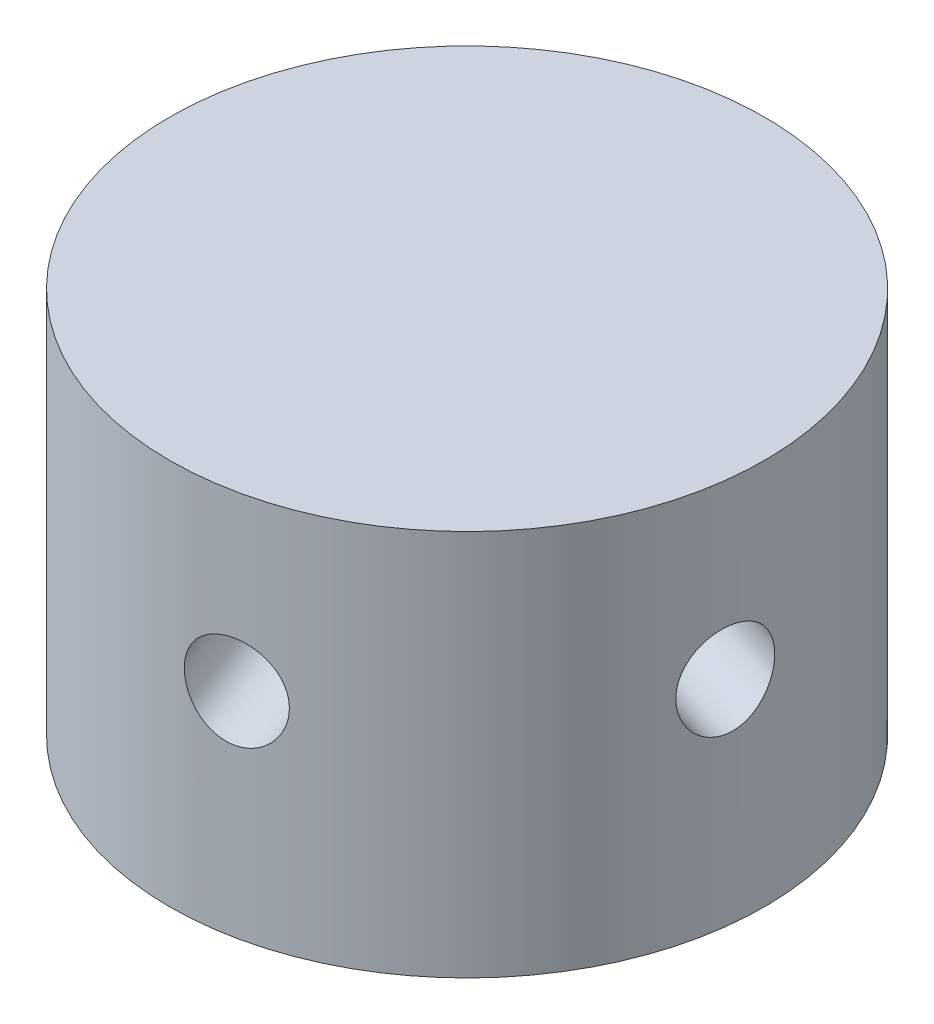
from build123d import *

# Parameters (mm, degrees)
BOSS_EXTRUDE1_DEPTH      = 3
BOSS_EXTRUDE1_DEPTH_BACK = 10
SKETCH1_R                = 10
SKETCH4_R                = 1.5
HOLE_DEPTH               = 20.973741561
HOLECIR_COUNT            = 5
SKETCH6_R                = 3
BEARINGHOLE_DEPTH        = 1.25
SKETCH7_R                = 1.5
SHAFTHOLE_DEPTH          = 17.248076982
SKETCH8_W                = 1.346153846
SKETCH8_H                = 0.358974359
SKETCH8_W_2              = 0.314102564
SKETCH8_H_2              = 2.557692308
BOSS_EXTRUDE3_DEPTH      = 1


with BuildPart() as part:
    # Sketch1 → Boss-Extrude1 (new, two sides: drawn at the far end of the back side and taken through both)
    with BuildSketch(Plane(origin=(0, 0, 0), x_dir=(1, 0, 0), z_dir=(0, 1, 0)).offset(-BOSS_EXTRUDE1_DEPTH_BACK)):
        Circle(SKETCH1_R)
    extrude(amount=BOSS_EXTRUDE1_DEPTH + BOSS_EXTRUDE1_DEPTH_BACK)

    # Sketch4 → hole (cut, through all)
    with BuildSketch(Plane(origin=(-3.352872105, -1.093066116, 1.887711608), x_dir=(-0.4486862613641547, -0.14627571033740308, -0.8816371449912632), z_dir=(0.8382180262940947, 0.2732665289126682, -0.47192790187872385))):
        Circle(SKETCH4_R)
    hole = extrude(amount=-HOLE_DEPTH, mode=Mode.SUBTRACT)

    # holecir: hole ×5 about axis
    holecir_axis = Axis((0, 5.5, 0), (0, -1, 0))
    for i in range(1, HOLECIR_COUNT):
        add(hole.rotate(holecir_axis, i * 360 / HOLECIR_COUNT), mode=Mode.SUBTRACT)

    # Sketch6 → bearinghole (cut, symmetric)
    with BuildSketch(Plane(origin=(0, -5, 0), x_dir=(-1, 0, 0), z_dir=(0, -1, 0))):
        Circle(SKETCH6_R)
    extrude(amount=BEARINGHOLE_DEPTH, both=True, mode=Mode.SUBTRACT)

    # Sketch7 → shafthole (cut, through all)
    with BuildSketch(Plane(origin=(0, -5, 0), x_dir=(-1, 0, 0), z_dir=(0, -1, 0))):
        Circle(SKETCH7_R)
    extrude(amount=SHAFTHOLE_DEPTH, mode=Mode.SUBTRACT)

    # Sketch8 → Boss-Extrude3 (add)
    # profile 1 of 7: a face of its own
    with BuildSketch(Plane.XZ.offset(10)):
        with BuildLine():
            Line((-4.105763014, 6.129780863), (-4.105763014, 5.770806504))
            Line((-4.105763014, 5.770806504), (-5.296267821, 5.770806504))
            Line((-5.296267821, 5.770806504), (-5.484869584, 4.850233588))
            add(Edge.make_bspline(
                [(-5.484869584, 4.850233588), (-5.44781371, 4.860463859), (-5.376023814, 4.880283393), (-5.270063953, 4.902289163), (-5.16947175, 4.915554607), (-5.104196379, 4.917365918), (-5.072609969, 4.918242402)],
                knots=[0, 0, 0, 0, 1.100273476, 2.13160584, 3.095893838, 4, 4, 4, 4], degree=3))
            add(Edge.make_bspline(
                [(-5.072609969, 4.918242402), (-5.033526229, 4.917396466), (-4.956677832, 4.915733145), (-4.844238885, 4.899761296), (-4.736905992, 4.874621381), (-4.634903621, 4.839500859), (-4.538043071, 4.794591126), (-4.447215509, 4.738491186), (-4.361057596, 4.672957855), (-4.281115002, 4.597612843), (-4.208590694, 4.514691226), (-4.144824705, 4.425533355), (-4.090662114, 4.331005693), (-4.047101359, 4.230205084), (-4.012317025, 4.12424593), (-3.98916503, 4.012013348), (-3.973748321, 3.894565228), (-3.972025935, 3.814260658), (-3.971147629, 3.773310511)],
                knots=[0, 0, 0, 0, 1.052922333, 2.070308379, 3.05430497, 4.020497103, 4.973039431, 5.925935799, 6.892292201, 7.88610001, 8.88166317, 9.857072816, 10.836096531, 11.812156883, 12.81219415, 13.836441305, 14.89672472, 16, 16, 16, 16], degree=3))
            add(Edge.make_bspline(
                [(-3.971147629, 3.773310511), (-3.971812704, 3.74478829), (-3.973133867, 3.688129303), (-3.979852455, 3.603985102), (-3.992788171, 3.521622269), (-4.010155895, 3.441029877), (-4.032698313, 3.362360505), (-4.059987367, 3.285388977), (-4.093383394, 3.21059437), (-4.13001477, 3.137268975), (-4.171261248, 3.067070468), (-4.217039755, 3.001421481), (-4.265405246, 2.9393372), (-4.317446632, 2.881483467), (-4.373647627, 2.828240449), (-4.433327594, 2.779292168), (-4.496010313, 2.733810837), (-4.562665555, 2.693642642), (-4.631808038, 2.656679686), (-4.704436255, 2.626356149), (-4.778896955, 2.599245621), (-4.856261831, 2.577636093), (-4.936355644, 2.560703538), (-5.019310419, 2.549202938), (-5.104691089, 2.5408265), (-5.162566102, 2.540302143), (-5.191800674, 2.540037273)],
                knots=[0, 0, 0, 0, 1.056347294, 2.098418968, 3.122841568, 4.141288669, 5.149314143, 6.15115421, 7.162517403, 8.180376062, 9.185164535, 10.17417709, 11.141909838, 12.097768115, 13.052685741, 14.0056014, 14.954263652, 15.917497458, 16.885230207, 17.854509472, 18.828990115, 19.81800267, 20.826176721, 21.857883937, 22.917946725, 24, 24, 24, 24], degree=3))
            add(Edge.make_bspline(
                [(-5.191800674, 2.540037273), (-5.226674855, 2.540728111), (-5.295285685, 2.542087254), (-5.395806253, 2.556305739), (-5.492520858, 2.576669655), (-5.584650959, 2.607305925), (-5.673022223, 2.64569322), (-5.756444941, 2.694209391), (-5.837050717, 2.749188495), (-5.911562754, 2.814068848), (-5.980718867, 2.88498453), (-6.042625376, 2.961942171), (-6.097758953, 3.043671613), (-6.1452367, 3.130569767), (-6.185734721, 3.222408298), (-6.217549709, 3.319531299), (-6.243228064, 3.421431303), (-6.254091485, 3.491584814), (-6.259609168, 3.527216761)],
                knots=[0, 0, 0, 0, 1.0467383, 2.05933395, 3.04377827, 4.011590433, 4.970194871, 5.932262533, 6.905835911, 7.896367577, 8.894135286, 9.877477877, 10.858688626, 11.851381753, 12.8477658, 13.868841284, 14.917554742, 16, 16, 16, 16], degree=3))
            Line((-6.259609168, 3.527216761), (-5.945506604, 3.527216761))
            add(Edge.make_bspline(
                [(-5.945506604, 3.527216761), (-5.937778046, 3.493840308), (-5.92292333, 3.429688913), (-5.890317581, 3.339557572), (-5.850451705, 3.259238348), (-5.803047357, 3.187668765), (-5.746497327, 3.125259768), (-5.681967898, 3.069642706), (-5.609620174, 3.019467577), (-5.529226945, 2.977644809), (-5.444413866, 2.941976056), (-5.355646656, 2.918224361), (-5.265342309, 2.901523468), (-5.204263939, 2.899851707), (-5.173571507, 2.899011632)],
                knots=[0, 0, 0, 0, 1.136247022, 2.183929868, 3.172523383, 4.106158343, 5.02341133, 5.958108904, 6.928429099, 7.938127109, 8.96079061, 9.975095812, 10.982467395, 12, 12, 12, 12], degree=3))
            add(Edge.make_bspline(
                [(-5.173571507, 2.899011632), (-5.143613063, 2.89983241), (-5.084624641, 2.901448529), (-4.997813254, 2.913887541), (-4.91400038, 2.933045112), (-4.834013023, 2.961714967), (-4.756451484, 2.996559686), (-4.683277713, 3.041274761), (-4.612374836, 3.09273478), (-4.545946702, 3.15169141), (-4.485107253, 3.216661104), (-4.431351132, 3.286138498), (-4.386574219, 3.360255344), (-4.34884011, 3.437728497), (-4.320186811, 3.519407054), (-4.29974583, 3.60490823), (-4.287742771, 3.69444321), (-4.286091591, 3.75551252), (-4.285250193, 3.786631825)],
                knots=[0, 0, 0, 0, 1.027316725, 2.022795036, 3.002884548, 3.971462791, 4.93288096, 5.914575861, 6.907176829, 7.935150275, 8.956128384, 9.956726525, 10.942570165, 11.921478529, 12.907843606, 13.90538589, 14.932640048, 16, 16, 16, 16], degree=3))
            add(Edge.make_bspline(
                [(-4.285250193, 3.786631825), (-4.285908673, 3.814707576), (-4.287197553, 3.869661865), (-4.297728123, 3.950061072), (-4.316045095, 4.026134114), (-4.341468975, 4.098248348), (-4.373748483, 4.16647179), (-4.413194795, 4.230874851), (-4.460548193, 4.290608684), (-4.514640082, 4.345701238), (-4.573898123, 4.396546112), (-4.639341865, 4.439890199), (-4.709601792, 4.476354116), (-4.783831392, 4.507822115), (-4.86379629, 4.53042286), (-4.947912923, 4.547390746), (-5.03708963, 4.557206108), (-5.098060319, 4.558567997), (-5.129400834, 4.559268043)],
                knots=[0, 0, 0, 0, 1.045622112, 2.046656509, 3.013763289, 3.955457236, 4.890082067, 5.820317437, 6.762574623, 7.722996705, 8.69280354, 9.665887285, 10.63943826, 11.638615906, 12.663482002, 13.728887084, 14.832589034, 16, 16, 16, 16], degree=3))
            add(Edge.make_bspline(
                [(-5.129400834, 4.559268043), (-5.156529763, 4.558687452), (-5.212544118, 4.557488678), (-5.298466945, 4.548662181), (-5.388758668, 4.534422887), (-5.483073164, 4.514836639), (-5.581693672, 4.489205563), (-5.684412073, 4.458491062), (-5.791444339, 4.421769063), (-5.863562064, 4.39403685), (-5.900634809, 4.379780863)],
                knots=[0, 0, 0, 0, 0.817624296, 1.688186739, 2.600797293, 3.572016777, 4.590301741, 5.671205678, 6.80286297, 8, 8, 8, 8], degree=3))
            Line((-5.900634809, 4.379780863), (-5.54166045, 6.129780863))
            Line((-5.54166045, 6.129780863), (-4.105763014, 6.129780863))
        make_face()
    # profile 2 of 7: a face of its own
    with BuildSketch(Plane.XZ.offset(10)):
        with Locations((-2.939096347, 3.97593471)):
            Rectangle(SKETCH8_W, SKETCH8_H)
    # profile 3 of 7: a face of its own
    with BuildSketch(Plane.XZ.offset(10)):
        with BuildLine():
            Line((0.830134422, 5.187473171), (0.830134422, 2.629780863))
            Line((0.830134422, 2.629780863), (0.516031858, 2.629780863))
            Line((0.516031858, 2.629780863), (0.516031858, 3.072188716))
            add(Edge.make_bspline(
                [(0.516031858, 3.072188716), (0.480613067, 3.032149122), (0.411492852, 2.954011351), (0.296051734, 2.851929178), (0.173683556, 2.767550857), (0.044982235, 2.699400941), (-0.089936008, 2.648208885), (-0.230772096, 2.611822726), (-0.377583476, 2.58842889), (-0.477835831, 2.586092868), (-0.528639616, 2.584909068)],
                knots=[0, 0, 0, 0, 1.074387032, 2.096679803, 3.090159297, 4.057316773, 5.018401886, 5.985159533, 6.978961417, 8, 8, 8, 8], degree=3))
            add(Edge.make_bspline(
                [(-0.528639616, 2.584909068), (-0.57380757, 2.586135441), (-0.662880775, 2.588553901), (-0.793909852, 2.607316205), (-0.920002102, 2.637446826), (-1.041276674, 2.679347716), (-1.15694882, 2.734928537), (-1.268008916, 2.801469785), (-1.373881608, 2.880710616), (-1.472953147, 2.971298644), (-1.564185148, 3.069693631), (-1.64424642, 3.174639178), (-1.7109995, 3.285681482), (-1.766819581, 3.401414636), (-1.809815925, 3.522729555), (-1.83978956, 3.649206723), (-1.858530006, 3.780696597), (-1.860947467, 3.87023612), (-1.86217327, 3.915638235)],
                knots=[0, 0, 0, 0, 1.033919861, 2.038935746, 3.024066025, 3.998881131, 4.97069526, 5.957263378, 6.95902576, 7.993208707, 9.027059324, 10.027763471, 11.009749337, 11.988697705, 12.965288445, 13.950418724, 14.960734635, 16, 16, 16, 16], degree=3))
            add(Edge.make_bspline(
                [(-1.86217327, 3.915638235), (-1.860920299, 3.960101939), (-1.858443242, 4.048004282), (-1.839990022, 4.17728298), (-1.808959013, 4.301801241), (-1.765411166, 4.421158184), (-1.709569211, 4.535498234), (-1.641641124, 4.644902259), (-1.561621999, 4.749671656), (-1.469369592, 4.847342883), (-1.369434822, 4.937563498), (-1.262526091, 5.015972543), (-1.15130281, 5.083689392), (-1.034039799, 5.137342868), (-0.912472694, 5.180751973), (-0.785519249, 5.210784941), (-0.65370767, 5.228482262), (-0.564217178, 5.231045026), (-0.518823911, 5.232344966)],
                knots=[0, 0, 0, 0, 1.020392517, 2.01726096, 2.990465484, 3.961182959, 4.928053699, 5.906110375, 6.912531644, 7.948652711, 8.985773172, 9.998621852, 10.987621588, 11.969261332, 12.953316658, 13.946091881, 14.958173133, 16, 16, 16, 16], degree=3))
            add(Edge.make_bspline(
                [(-0.518823911, 5.232344966), (-0.466624052, 5.230907214), (-0.364262592, 5.228087851), (-0.214534583, 5.204625124), (-0.072890105, 5.164986657), (0.061764247, 5.111069159), (0.188944933, 5.03942043), (0.307447917, 4.949040469), (0.418513401, 4.840499282), (0.482893692, 4.757128837), (0.516031858, 4.714215959)],
                knots=[0, 0, 0, 0, 1.038897134, 2.037228247, 3.008116434, 3.962042015, 4.918381754, 5.904844433, 6.921570401, 8, 8, 8, 8], degree=3))
            Line((0.516031858, 4.714215959), (0.516031858, 5.187473171))
            Line((0.516031858, 5.187473171), (0.830134422, 5.187473171))
        make_face()
        with BuildLine():
            add(Edge.make_bspline(
                [(-0.51461718, 4.918242402), (-0.560531518, 4.916608764), (-0.651159118, 4.913384223), (-0.78420312, 4.888210728), (-0.911516534, 4.846326133), (-1.032462609, 4.789044232), (-1.145130825, 4.717015496), (-1.245824496, 4.629894112), (-1.335367198, 4.530057098), (-1.410675462, 4.417954988), (-1.472065959, 4.297776897), (-1.515232991, 4.172152459), (-1.543702238, 4.043347481), (-1.546610759, 3.955984795), (-1.548070706, 3.912132626)],
                knots=[0, 0, 0, 0, 1.031046209, 2.035121221, 3.029706178, 4.034933723, 5.034054252, 6.02443088, 7.017295772, 8.038157696, 9.050218397, 10.03989886, 11.016116709, 12, 12, 12, 12], degree=3))
            add(Edge.make_bspline(
                [(-1.548070706, 3.912132626), (-1.546205813, 3.868542519), (-1.542483336, 3.781533163), (-1.515732642, 3.652552586), (-1.470852768, 3.526898544), (-1.409610705, 3.405637551), (-1.332924081, 3.29305345), (-1.244035428, 3.191313328), (-1.142085147, 3.103823739), (-1.02915764, 3.030586166), (-0.908549669, 2.971423645), (-0.781715738, 2.930258005), (-0.6510401, 2.903680225), (-0.562187766, 2.900575748), (-0.517421668, 2.899011632)],
                knots=[0, 0, 0, 0, 0.979072187, 1.954306742, 2.945804271, 3.96968567, 4.997920485, 5.998718438, 6.996577872, 8.005894225, 9.015743152, 10.005417472, 10.995077863, 12, 12, 12, 12], degree=3))
            add(Edge.make_bspline(
                [(-0.517421668, 2.899011632), (-0.471975165, 2.900671596), (-0.381586578, 2.9039731), (-0.24814787, 2.929254365), (-0.118652908, 2.971023164), (0.005134321, 3.02892229), (0.120450452, 3.100679646), (0.223948329, 3.184686737), (0.311464298, 3.282389921), (0.385656907, 3.389766374), (0.443832324, 3.507478371), (0.486208383, 3.632812562), (0.511262289, 3.76577331), (0.514420019, 3.856637237), (0.516031858, 3.903018043)],
                knots=[0, 0, 0, 0, 1.01762866, 2.023962475, 3.030623092, 4.058876274, 5.077231937, 6.066672613, 7.034107872, 8.005628644, 8.981990164, 9.965428785, 10.961468474, 12, 12, 12, 12], degree=3))
            add(Edge.make_bspline(
                [(0.516031858, 3.903018043), (0.515072202, 3.938355873), (0.513183294, 4.007911907), (0.498752725, 4.110039424), (0.475797798, 4.20777315), (0.443451628, 4.301215839), (0.400960344, 4.389850855), (0.349712578, 4.474314615), (0.288807128, 4.554167826), (0.219224432, 4.628310897), (0.14305923, 4.695937359), (0.062464689, 4.7563016), (-0.023514058, 4.805890373), (-0.113431095, 4.846931644), (-0.207442429, 4.879590794), (-0.306313049, 4.901378488), (-0.408992036, 4.916338809), (-0.479038092, 4.91760119), (-0.51461718, 4.918242402)],
                knots=[0, 0, 0, 0, 1.050140795, 2.067009409, 3.05949893, 4.030605086, 5.00011959, 5.97591094, 6.962425594, 7.979863591, 8.993523472, 9.986985069, 10.967611495, 11.937549037, 12.921786183, 13.919465291, 14.943216303, 16, 16, 16, 16], degree=3))
        make_face(mode=Mode.SUBTRACT)
    # profile 4 of 7: a face of its own
    with BuildSketch(Plane.XZ.offset(10)):
        Polygon((1.323724166, 5.187473171), (1.697422082, 5.187473171), (2.355775448, 4.264796889), (3.014128813, 5.187473171), (3.38782673, 5.187473171), (2.542974967, 4.003278459), (3.522442114, 2.629780863), (3.148744198, 2.629780863), (2.355775448, 3.741058908), (1.562806698, 2.629780863), (1.189108781, 2.629780863), (2.16927705, 4.003278459), align=None)
    # profile 5 of 7: a face of its own
    with BuildSketch(Plane.XZ.offset(10)):
        with BuildLine():
            add(Edge.make_bspline(
                [(3.992193717, 6.264396248), (4.011685033, 6.263492095), (4.049852773, 6.261721591), (4.10504604, 6.246560114), (4.155303052, 6.220860429), (4.199880785, 6.186380748), (4.238132672, 6.145831305), (4.264913382, 6.098570336), (4.282125778, 6.047511697), (4.284204334, 6.011896608), (4.285262627, 5.993763235)],
                knots=[0, 0, 0, 0, 1.055194115, 2.066272739, 3.074728998, 4.095836921, 5.109056067, 6.073838105, 7.019297344, 8, 8, 8, 8], degree=3))
            add(Edge.make_bspline(
                [(4.285262627, 5.993763235), (4.284180467, 5.976100582), (4.282041166, 5.941183607), (4.264926677, 5.891010135), (4.237904439, 5.844405851), (4.199905314, 5.803935141), (4.155296553, 5.769474521), (4.105047767, 5.743769782), (4.049852318, 5.728609645), (4.011684879, 5.726838956), (3.992193717, 5.725934709)],
                knots=[0, 0, 0, 0, 0.96129708, 1.900370562, 2.859976407, 3.87933698, 4.906634145, 5.921202961, 6.938410037, 8, 8, 8, 8], degree=3))
            add(Edge.make_bspline(
                [(3.992193717, 5.725934709), (3.972925442, 5.72680443), (3.935422262, 5.728497226), (3.881055419, 5.744067244), (3.83122693, 5.769483317), (3.786562257, 5.803709502), (3.749332064, 5.8446544), (3.722233739, 5.890981693), (3.705158777, 5.941190848), (3.703014148, 5.976103014), (3.701929294, 5.993763235)],
                knots=[0, 0, 0, 0, 1.054934014, 2.053291228, 3.073705704, 4.106921865, 5.123545215, 6.088680038, 7.033164197, 8, 8, 8, 8], degree=3))
            add(Edge.make_bspline(
                [(3.701929294, 5.993763235), (3.702990381, 6.011894085), (3.705074422, 6.047504217), (3.722246538, 6.09859925), (3.749106345, 6.145580752), (3.786586909, 6.186606251), (3.831220369, 6.220851686), (3.881057114, 6.246262668), (3.935421814, 6.261834007), (3.97292529, 6.263526621), (3.992193717, 6.264396248)],
                knots=[0, 0, 0, 0, 0.98631895, 1.937192651, 2.907499808, 3.917963147, 4.944918757, 5.95915025, 6.951458133, 8, 8, 8, 8], degree=3))
        make_face()
    # profile 6 of 7: a face of its own
    with BuildSketch(Plane.XZ.offset(10)):
        with Locations((3.993595961, 3.908627017)):
            Rectangle(SKETCH8_W_2, SKETCH8_H_2)
    # profile 7 of 7: a face of its own
    with BuildSketch(Plane.XZ.offset(10)):
        with BuildLine():
            Line((6.125006217, 4.868462754), (5.911865191, 4.649011632))
            add(Edge.make_bspline(
                [(5.911865191, 4.649011632), (5.893474688, 4.670324779), (5.858019962, 4.711414016), (5.801788481, 4.766351082), (5.745764877, 4.812488021), (5.690716064, 4.85144028), (5.635257795, 4.880889427), (5.580040877, 4.902384289), (5.525008138, 4.915686094), (5.488222103, 4.917400533), (5.470158461, 4.918242402)],
                knots=[0, 0, 0, 0, 1.26578478, 2.440284043, 3.530471711, 4.527705817, 5.468200915, 6.346673037, 7.188140097, 8, 8, 8, 8], degree=3))
            add(Edge.make_bspline(
                [(5.470158461, 4.918242402), (5.448019071, 4.917167529), (5.404451885, 4.915052331), (5.342026066, 4.8939389), (5.284075441, 4.861530162), (5.233918461, 4.815561578), (5.191430781, 4.76279731), (5.1604171, 4.703800985), (5.141451117, 4.640352941), (5.139046385, 4.596323083), (5.13782673, 4.5739916)],
                knots=[0, 0, 0, 0, 0.99966794, 1.967205029, 2.953328237, 3.988086729, 5.028030931, 6.008226631, 6.989793394, 8, 8, 8, 8], degree=3))
            add(Edge.make_bspline(
                [(5.13782673, 4.5739916), (5.138937542, 4.553779556), (5.141156035, 4.513412445), (5.158402714, 4.453864412), (5.185868787, 4.395807373), (5.211538981, 4.360244467), (5.224765832, 4.341920286)],
                knots=[0, 0, 0, 0, 0.960159726, 1.917612774, 2.927026955, 4, 4, 4, 4], degree=3))
            add(Edge.make_bspline(
                [(5.224765832, 4.341920286), (5.232729326, 4.332135702), (5.249678619, 4.311310447), (5.281487134, 4.282406594), (5.317509637, 4.250464343), (5.360829575, 4.218527506), (5.409580602, 4.184895781), (5.464819887, 4.150893648), (5.524794392, 4.113929223), (5.567731698, 4.090484787), (5.590050287, 4.078298491)],
                knots=[0, 0, 0, 0, 0.66740084, 1.420478572, 2.27185888, 3.217733974, 4.268547843, 5.408967954, 6.65319498, 8, 8, 8, 8], degree=3))
            add(Edge.make_bspline(
                [(5.590050287, 4.078298491), (5.617263865, 4.063053589), (5.669831535, 4.033605456), (5.744524302, 3.987895753), (5.812311343, 3.942464328), (5.873767011, 3.897797055), (5.927708819, 3.852644187), (5.975773372, 3.80873643), (6.016761816, 3.764747122), (6.039715743, 3.734014008), (6.050687307, 3.719324132)],
                knots=[0, 0, 0, 0, 1.27191281, 2.456916733, 3.569705269, 4.599008579, 5.553216877, 6.436649441, 7.252746552, 8, 8, 8, 8], degree=3))
            add(Edge.make_bspline(
                [(6.050687307, 3.719324132), (6.068897834, 3.689658044), (6.105140163, 3.630617023), (6.14319843, 3.533398596), (6.165258705, 3.430288093), (6.168320925, 3.359755873), (6.169878012, 3.32389144)],
                knots=[0, 0, 0, 0, 0.995354457, 1.980940102, 2.973342416, 4, 4, 4, 4], degree=3))
            add(Edge.make_bspline(
                [(6.169878012, 3.32389144), (6.169158478, 3.298622294), (6.167740558, 3.248826681), (6.157882491, 3.175491851), (6.140927515, 3.105357294), (6.117833761, 3.037662009), (6.086649388, 2.973703069), (6.050101591, 2.91186682), (6.006226679, 2.853490889), (5.956135303, 2.798651929), (5.901289809, 2.748566182), (5.842783671, 2.704542228), (5.78054484, 2.667967891), (5.715018039, 2.637702546), (5.646054385, 2.613634288), (5.573643096, 2.596971756), (5.498014341, 2.586998995), (5.446584533, 2.585614519), (5.420378813, 2.584909068)],
                knots=[0, 0, 0, 0, 1.032770009, 2.035186124, 3.017557409, 3.978232242, 4.952395191, 5.920591857, 6.910227898, 7.931268572, 8.952309245, 9.941945286, 10.918353717, 11.897095711, 12.887975737, 13.898235213, 14.929059601, 16, 16, 16, 16], degree=3))
            add(Edge.make_bspline(
                [(5.420378813, 2.584909068), (5.385011638, 2.585901769), (5.314768711, 2.587873376), (5.210878992, 2.606379437), (5.109358233, 2.635174831), (5.010974693, 2.674890765), (4.917928579, 2.725041478), (4.832797654, 2.785103872), (4.755286192, 2.853093869), (4.711167918, 2.90520678), (4.689108781, 2.931263235)],
                knots=[0, 0, 0, 0, 1.013940152, 2.01379169, 3.017749504, 4.037548394, 5.051665909, 6.043208538, 7.021604269, 8, 8, 8, 8], degree=3))
            Line((4.689108781, 2.931263235), (4.897341954, 3.168242402))
            add(Edge.make_bspline(
                [(4.897341954, 3.168242402), (4.917114367, 3.146887637), (4.955446179, 3.105488197), (5.016747396, 3.050363857), (5.079126797, 3.004162585), (5.141961484, 2.965519171), (5.206181578, 2.935743767), (5.271427192, 2.914825174), (5.337565616, 2.901380981), (5.381987752, 2.899802699), (5.404253012, 2.899011632)],
                knots=[0, 0, 0, 0, 1.179806542, 2.287233372, 3.337373186, 4.324005949, 5.273901747, 6.200048787, 7.097828587, 8, 8, 8, 8], degree=3))
            add(Edge.make_bspline(
                [(5.404253012, 2.899011632), (5.434570938, 2.900382457), (5.493807079, 2.903060819), (5.578650838, 2.927377911), (5.656989464, 2.965507863), (5.72501281, 3.019592561), (5.782914971, 3.082548134), (5.824843145, 3.153462253), (5.851119321, 3.23025371), (5.85420532, 3.283486012), (5.855775448, 3.310570126)],
                knots=[0, 0, 0, 0, 1.072336372, 2.095165389, 3.102688358, 4.141489647, 5.156069229, 6.117746104, 7.042326257, 8, 8, 8, 8], degree=3))
            add(Edge.make_bspline(
                [(5.855775448, 3.310570126), (5.854689153, 3.332879745), (5.852544411, 3.3769271), (5.835701139, 3.440677441), (5.809088286, 3.501146722), (5.782883638, 3.536536369), (5.769537467, 3.554560511)],
                knots=[0, 0, 0, 0, 1.013901739, 2.00181326, 2.98231254, 4, 4, 4, 4], degree=3))
            add(Edge.make_bspline(
                [(5.769537467, 3.554560511), (5.761515073, 3.563595873), (5.7440394, 3.583278155), (5.711984159, 3.611703234), (5.673602297, 3.642341333), (5.628462134, 3.674672922), (5.576472672, 3.708271527), (5.517423196, 3.742960879), (5.452122644, 3.780388605), (5.405952013, 3.80520826), (5.381817114, 3.818182306)],
                knots=[0, 0, 0, 0, 0.615000592, 1.339693406, 2.178160186, 3.116406724, 4.166410947, 5.330106347, 6.604359322, 8, 8, 8, 8], degree=3))
            add(Edge.make_bspline(
                [(5.381817114, 3.818182306), (5.355770474, 3.832721437), (5.305257727, 3.860917453), (5.233710436, 3.904833534), (5.169163082, 3.949500808), (5.110062507, 3.992413648), (5.057901501, 4.035834592), (5.012885553, 4.079811843), (4.973242337, 4.122571829), (4.951294926, 4.152869126), (4.940811505, 4.167340959)],
                knots=[0, 0, 0, 0, 1.262093308, 2.447601706, 3.550203992, 4.582594899, 5.537233252, 6.418365656, 7.244515135, 8, 8, 8, 8], degree=3))
            add(Edge.make_bspline(
                [(4.940811505, 4.167340959), (4.922680906, 4.196486574), (4.886413371, 4.25478799), (4.851198179, 4.352098466), (4.826992151, 4.454543524), (4.82482976, 4.525230378), (4.823724166, 4.561371408)],
                knots=[0, 0, 0, 0, 0.985009483, 1.970363186, 2.962279964, 4, 4, 4, 4], degree=3))
            add(Edge.make_bspline(
                [(4.823724166, 4.561371408), (4.824258361, 4.584996806), (4.825303857, 4.631235057), (4.833647909, 4.699173877), (4.84883962, 4.763722031), (4.867894542, 4.825848894), (4.894377547, 4.884350988), (4.926023452, 4.940008459), (4.963210877, 4.992744377), (5.006054168, 5.041747509), (5.053160813, 5.086256836), (5.104055583, 5.125055464), (5.157593839, 5.158161818), (5.214002259, 5.185926979), (5.273822732, 5.206928362), (5.336637118, 5.221385747), (5.402318273, 5.231040949), (5.447219399, 5.231904034), (5.470158461, 5.232344966)],
                knots=[0, 0, 0, 0, 1.087655834, 2.128696564, 3.144119009, 4.137814668, 5.115653402, 6.093965665, 7.082169637, 8.081268856, 9.086088321, 10.061021666, 11.022561449, 11.980240094, 12.950172527, 13.934149372, 14.944599409, 16, 16, 16, 16], degree=3))
            add(Edge.make_bspline(
                [(5.470158461, 5.232344966), (5.497350524, 5.231240625), (5.552244746, 5.229011227), (5.634599372, 5.211305537), (5.716832714, 5.182172433), (5.799156064, 5.141936199), (5.880966353, 5.089869323), (5.96298321, 5.026940024), (6.04619124, 4.95356231), (6.098147553, 4.897463084), (6.125006217, 4.868462754)],
                knots=[0, 0, 0, 0, 0.845714091, 1.707292901, 2.609013841, 3.555613372, 4.552488639, 5.621697636, 6.770543573, 8, 8, 8, 8], degree=3))
        make_face()
    extrude(amount=BOSS_EXTRUDE3_DEPTH)


solid = part.part
